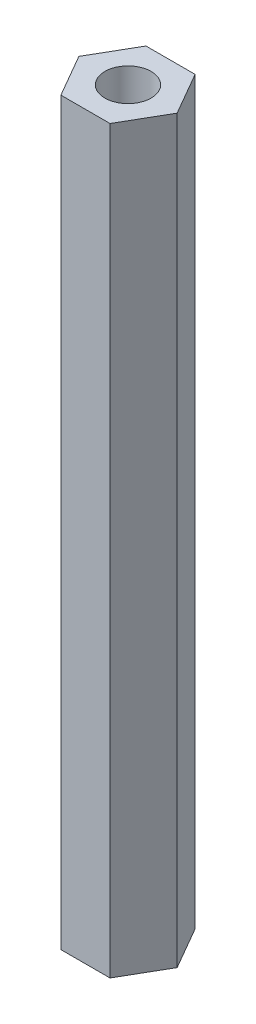
from build123d import *

# Parameters (mm, degrees)
EXTRUDE_1_DEPTH = 20
SKETCH_3_W      = 1.25
SKETCH_3_H      = 40.001


with BuildPart() as part:
    # 草图1 → 凸台-拉伸1 (new, symmetric)
    with BuildSketch(Plane(origin=(0, 0, 0), x_dir=(1, 0, 0), z_dir=(0, 1, 0))):
        Polygon((1.327905619, -2.3), (2.655811238, 0), (1.327905619, 2.3), (-1.327905619, 2.3), (-2.655811238, 0), (-1.327905619, -2.3), align=None)
    extrude(amount=EXTRUDE_1_DEPTH, both=True)

    # 草图3 → M3 螺纹孔1 (revolve, cut)
    with BuildSketch(Plane(origin=(0, 20, 0), x_dir=(0, 0, 1), z_dir=(1, 0, 0))):
        with Locations((0.625, 20.0005)):
            Rectangle(SKETCH_3_W, SKETCH_3_H)
    revolve(axis=Axis((0, 26.35, 0), (0, -1, 0)), mode=Mode.SUBTRACT)


solid = part.part
